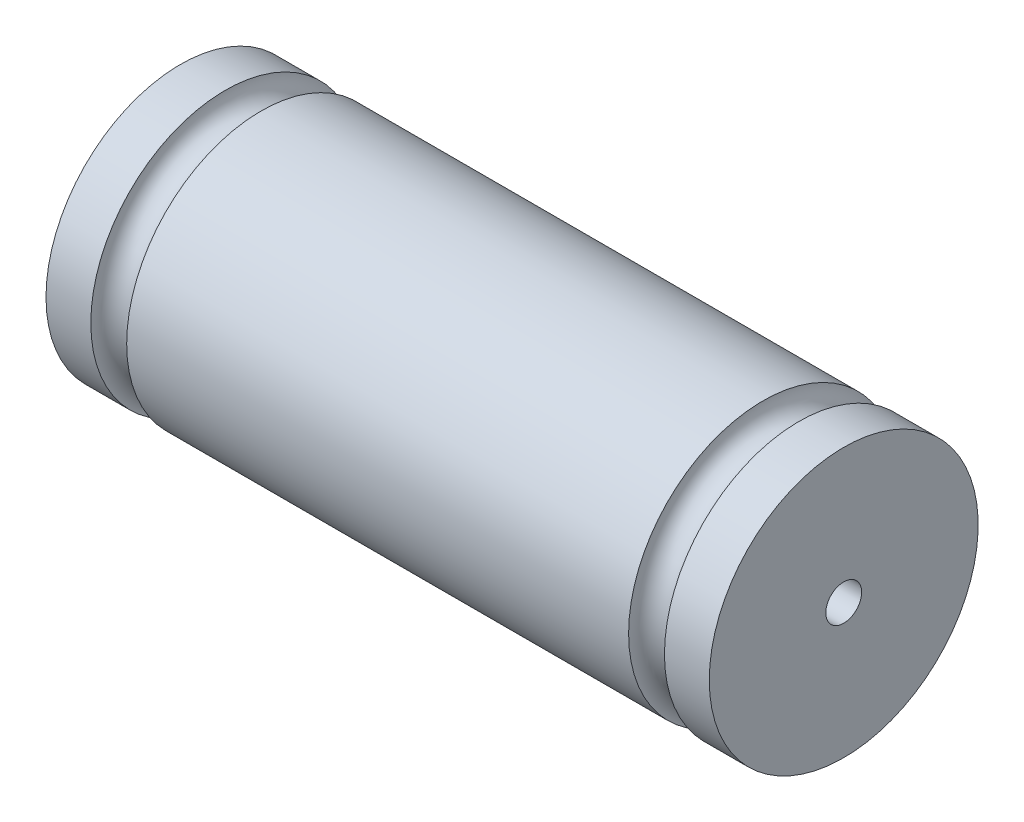
from build123d import *


with BuildPart() as part:
    # 草图1 → 旋转2 (revolve)
    with BuildSketch(Plane.XY, mode=Mode.PRIVATE) as revolve_2_sk:
        with BuildLine():
            Line((-32, 15), (-37, 15))
            Line((-37, 15), (-37, 2))
            Line((-37, 2), (37, 2))
            Line((37, 2), (37, 15))
            Line((37, 15), (32, 15))
            ThreePointArc((32, 15), (30, 13), (28, 15))
            Line((28, 15), (-28, 15))
            ThreePointArc((-28, 15), (-30, 13), (-32, 15))
        make_face()
    revolve(revolve_2_sk.sketch.rotate(Axis((0, 0, 0), (1, 0, 0)), 90), axis=Axis((0, 0, 0), (1, 0, 0)))


solid = part.part
